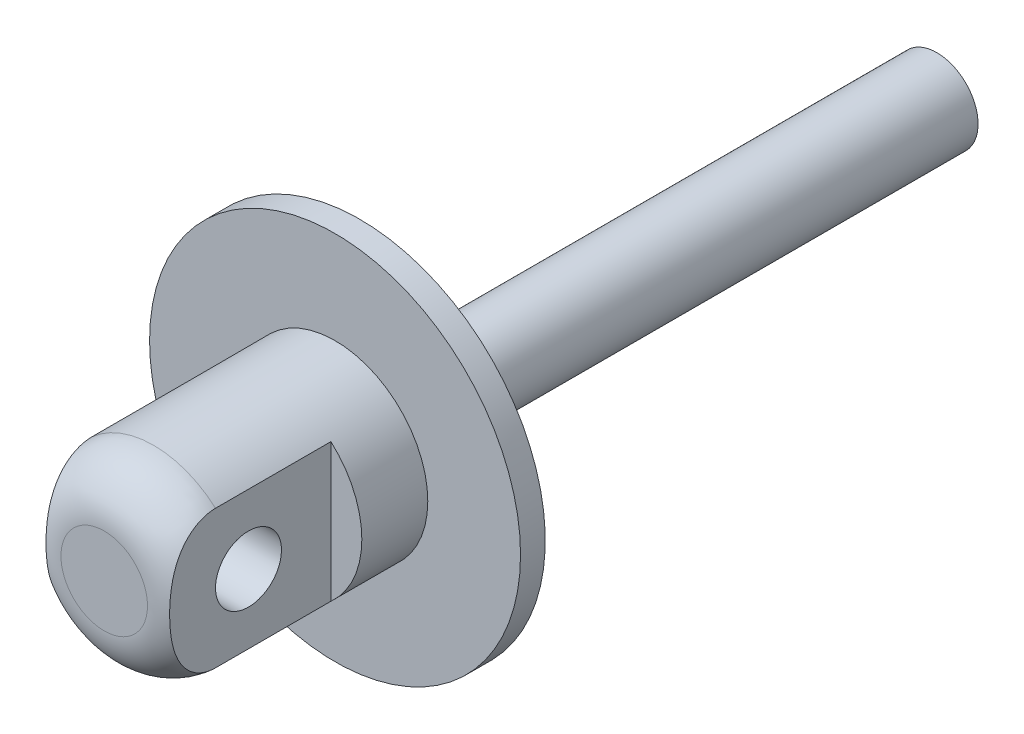
from build123d import *

# Parameters (mm, degrees)
ESQUISSE1_R             = 22.5
BOSS_EXTRU_1_DEPTH      = 101
ESQUISSE2_R             = 22.5
ESQUISSE2_R_2           = 5
ENL_V_MAT_EXTRU_1_DEPTH = 70
ENL_V_START             = -28
ESQUISSE3_R             = 22.5
ESQUISSE3_R_2           = 11.25
ENL_V_MAT_EXTRU_2_DEPTH = 28
CONG_1_R                = 6
ESQUISSE6_W             = 6.909858745
ESQUISSE6_H             = 23.056365404
ENL_V_MAT_EXTRU_3_DEPTH = 20
ESQUISSE7_R             = 4
ENL_V_MAT_EXTRU_4_DEPTH = 108.736948259


with BuildPart() as part:
    # Esquisse1 → Boss.-Extru.1 (new body)
    with BuildSketch(Plane.XY):
        Circle(ESQUISSE1_R)
    extrude(amount=BOSS_EXTRU_1_DEPTH)

    # Esquisse2 → Enlèv. mat.-Extru.1 (cut)
    with BuildSketch(Plane(origin=(0, 0, 0), x_dir=(-1, 0, 0), z_dir=(0, 0, -1))):
        Circle(ESQUISSE2_R)
        Circle(ESQUISSE2_R_2, mode=Mode.SUBTRACT)
    extrude(amount=-ENL_V_MAT_EXTRU_1_DEPTH, mode=Mode.SUBTRACT)

    # Esquisse3 → Enlèv. mat.-Extru.2 (cut)
    with BuildSketch(Plane.XY.offset(101).offset(ENL_V_START)):
        with Locations(Location((0, 0, 0), (0, 0, 180))):
            Circle(ESQUISSE3_R)
        Circle(ESQUISSE3_R_2, mode=Mode.SUBTRACT)
    extrude(amount=ENL_V_MAT_EXTRU_2_DEPTH, mode=Mode.SUBTRACT)

    # Congé1
    cong_1_edges = [part.edges().sort_by_distance(p)[0] for p in [
        (-11.25, 0, 101),
    ]]
    fillet(cong_1_edges, radius=CONG_1_R)

    # Esquisse6 → Enlèv. mat.-Extru.3 (cut)
    with BuildSketch(Plane.XY.offset(101)):
        with Locations((10.954929373, 0)):
            Rectangle(ESQUISSE6_W, ESQUISSE6_H)
        with Locations((-10.954929373, 0)):
            Rectangle(ESQUISSE6_W, ESQUISSE6_H)
    extrude(amount=-ENL_V_MAT_EXTRU_3_DEPTH, mode=Mode.SUBTRACT)

    # Esquisse7 → Enlèv. mat.-Extru.4 (cut, through all)
    with BuildSketch(Plane(origin=(7.5, 0, 0), x_dir=(0, 0, -1), z_dir=(1, 0, 0))):
        with Locations(Location((-91, 0, 0), (0, 0, 90))):
            Circle(ESQUISSE7_R)
    extrude(amount=-ENL_V_MAT_EXTRU_4_DEPTH, mode=Mode.SUBTRACT)


solid = part.part
